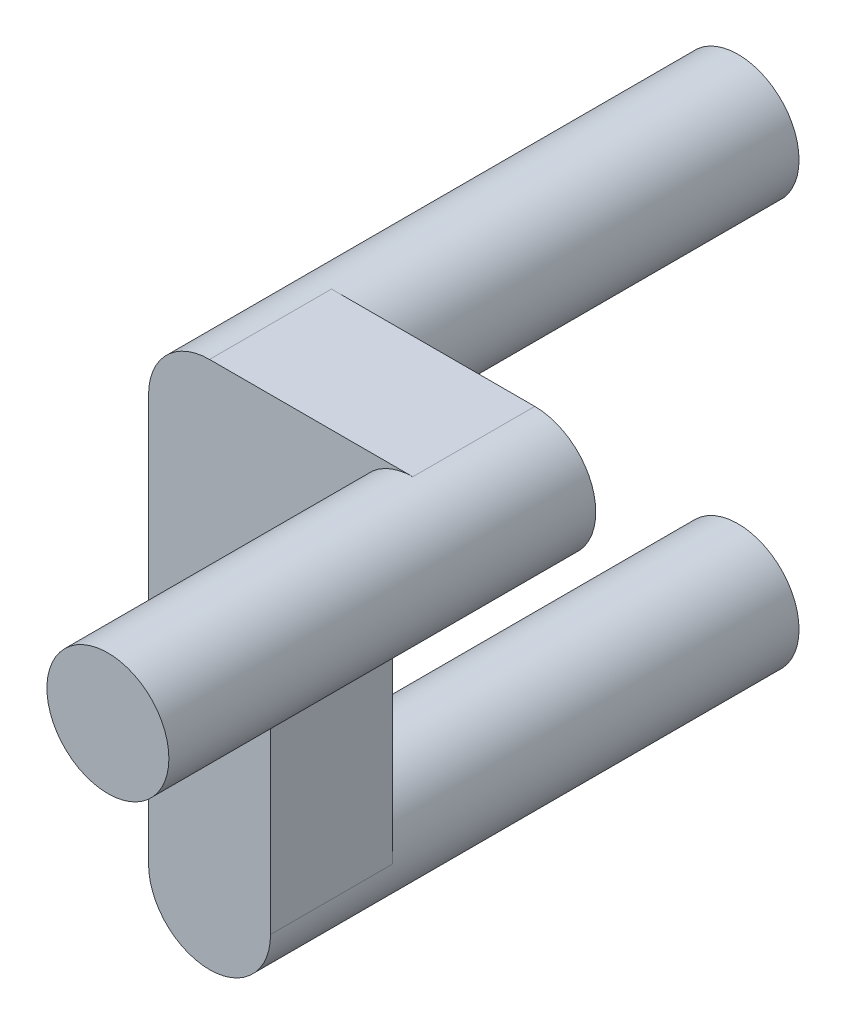
from build123d import *
from build123d.topology import SkipClean

# Parameters (mm, degrees)
SKETCH2_R                = 7.62
BOSS_EXTRUDE1_DEPTH      = 50.8
SKETCH2_R_2              = 7.619999999999999
BOSS_EXTRUDE1_2_DEPTH    = 50.8
SKETCH4_W                = 15.239999999999998
SKETCH4_H                = 15.239999999999998
BOSS_EXTRUDE3_DEPTH      = 15.239999999999998
SKETCH6_W                = 15.240000000000016
SKETCH6_H                = 15.239999999999998
BOSS_EXTRUDE4_DEPTH      = 25.4
SKETCH7_R                = 7.619999999999997
BOSS_EXTRUDE6_DEPTH      = 38.1
CUT_EXTRUDE1_DEPTH       = 86.10600000000002
CUT_EXTRUDE2_START       = -86.10600000000002
CUT_EXTRUDE2_DEPTH       = 86.10600000000002
BOSS_EXTRUDE7_DEPTH      = 50.8
BOSS_EXTRUDE7_DEPTH_BACK = 15.239999999999998
SKETCH10_W               = 15.239999999999998
SKETCH10_H               = 15.240000000000016
CUT_EXTRUDE6_DEPTH       = 92.45600000000002


with BuildPart() as part:
    # Sketch2 → Boss-Extrude1 (new body)
    with BuildSketch(Plane.XY):
        Circle(SKETCH2_R)
    extrude(amount=BOSS_EXTRUDE1_DEPTH)

    # Sketch4 → Boss-Extrude3 (add)
    with BuildSketch(Plane.XY.offset(50.8)):
        Rectangle(SKETCH4_W, SKETCH4_H)
    extrude(amount=BOSS_EXTRUDE3_DEPTH)

    # Sketch6 → Boss-Extrude4 (add)
    with BuildSketch(Plane(origin=(7.619999999999999, 0, 0), x_dir=(0, 0, -1), z_dir=(1, 0, 0))):
        with Locations((-58.42, 0)):
            Rectangle(SKETCH6_W, SKETCH6_H)
    extrude(amount=BOSS_EXTRUDE4_DEPTH)

    # Sketch7 → Boss-Extrude6 (add)
    with BuildSketch(Plane.XY.offset(66.04)):
        with Locations((25.400000000000002, 0)):
            Circle(SKETCH7_R)
    extrude(amount=BOSS_EXTRUDE6_DEPTH)

    # Sketch8 → Cut-Extrude1 (cut)
    with BuildSketch(Plane(origin=(0, 0, 0), x_dir=(-1, 0, 0), z_dir=(0, 0, -1))):
        with BuildLine():
            Line((7.619999999999999, 0), (7.619999999999999, 7.619999999999999))
            Line((7.619999999999999, 7.619999999999999), (3.2596e-13, 7.619999999999999))
            ThreePointArc((3.2702e-13, 7.62), (5.388153672641607, 5.388153672641376), (7.62, 0))
        make_face()
        with BuildLine():
            Line((7.619999999999999, -7.619999999999997), (7.619999999999999, 0))
            ThreePointArc((7.62, -1.87e-15), (5.3881536742144505, -5.388153671068534), (4.44899204e-09, -7.62))
            Line((4.44899229e-09, -7.619999999999997), (7.619999999999999, -7.619999999999997))
        make_face()
    extrude(amount=-CUT_EXTRUDE1_DEPTH, mode=Mode.SUBTRACT)

    # Sketch9 → Cut-Extrude2 (cut)
    with BuildSketch(Plane.XY.offset(104.14000000000001).offset(CUT_EXTRUDE2_START)):
        with BuildLine():
            Line((33.02, 0), (33.02, 7.619999999999999))
            Line((33.02, 7.619999999999999), (25.40000000000031, 7.619999999999999))
            ThreePointArc((25.40000000000031, 7.619999999999997), (30.788153672641602, 5.388153672641381), (33.019999999999996, 0))
        make_face()
        with BuildLine():
            Line((33.02, -7.619999999999997), (33.02, 0))
            ThreePointArc((33.019999999999996, -1.87e-15), (30.788153672641606, -5.388153672641376), (25.400000000000325, -7.619999999999997))
            Line((25.400000000000325, -7.619999999999997), (33.02, -7.619999999999997))
        make_face()
    extrude(amount=CUT_EXTRUDE2_DEPTH, mode=Mode.SUBTRACT)



with BuildPart() as body_2:
    # Sketch2 → Boss-Extrude1 2 (new body)
    with BuildSketch(Plane.XY):
        with Locations((6.22e-15, -50.8)):
            Circle(SKETCH2_R_2)
    extrude(amount=BOSS_EXTRUDE1_2_DEPTH)


with BuildPart() as part_1:
    add(part.part)

    add(body_2.part)  # Boss-Extrude7 merges body 2
    # Sketch10 → Boss-Extrude7 (add, two sides: drawn at the far end of the back side and taken through both)
    with BuildSketch(Plane.XZ.offset(7.619999999999999).offset(-BOSS_EXTRUDE7_DEPTH_BACK)):
        with Locations((0, 58.42)):
            Rectangle(SKETCH10_W, SKETCH10_H)
    extrude(amount=BOSS_EXTRUDE7_DEPTH + BOSS_EXTRUDE7_DEPTH_BACK)

    # Sketch13 → Cut-Extrude6 (cut)
    with SkipClean():  # the faces are left unmerged after this step: merging them gives an invalid solid
        with BuildSketch(Plane(origin=(0, 0, 0), x_dir=(-1, 0, 0), z_dir=(0, 0, -1))):
            with BuildLine():
                Line((7.619999999999999, 0), (7.619999999999999, 7.619999999999999))
                Line((7.619999999999999, 7.619999999999999), (3.2685e-13, 7.619999999999999))
                ThreePointArc((3.2702e-13, 7.62), (5.388153672641607, 5.388153672641376), (7.62, 0))
            make_face()
            with BuildLine():
                Line((3.895929446e-08, -58.42), (7.619999999999999, -58.42))
                Line((7.619999999999999, -58.42), (7.619999999999999, -50.8))
                ThreePointArc((7.619999999999991, -50.8), (5.388153686415675, -56.18815365886729), (3.895929121e-08, -58.419999999999995))
            make_face()
            with BuildLine():
                Line((-7.619999999999999, -58.42), (3.895929446e-08, -58.42))
                ThreePointArc((3.895929121e-08, -58.419999999999995), (-5.388153658867306, -56.18815368641568), (-7.620000000000004, -50.8))
                Line((-7.619999999999998, -50.8), (-7.619999999999998, -58.42))
            make_face()
        extrude(amount=-CUT_EXTRUDE6_DEPTH, mode=Mode.SUBTRACT)


solid = part_1.part
